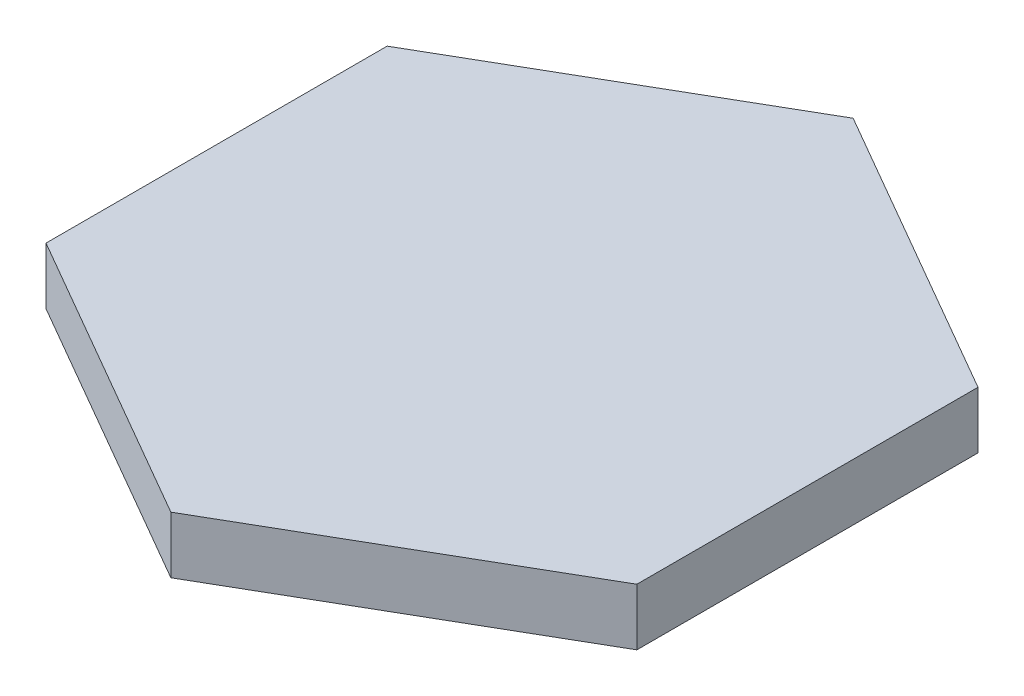
from build123d import *

# Parameters (mm, degrees)
BOSS_EXTRUDE1_DEPTH = 6.35


with BuildPart() as part:
    # Sketch1 → Boss-Extrude1 (new body)
    with BuildSketch(Plane(origin=(0, 0, 0), x_dir=(1, 0, 0), z_dir=(0, 1, 0))):
        Polygon((32.995567884, 19.05), (0, 38.1), (-32.995567884, 19.05), (-32.995567884, -19.05), (0, -38.1), (32.995567884, -19.05), align=None)
    extrude(amount=-BOSS_EXTRUDE1_DEPTH)


solid = part.part
